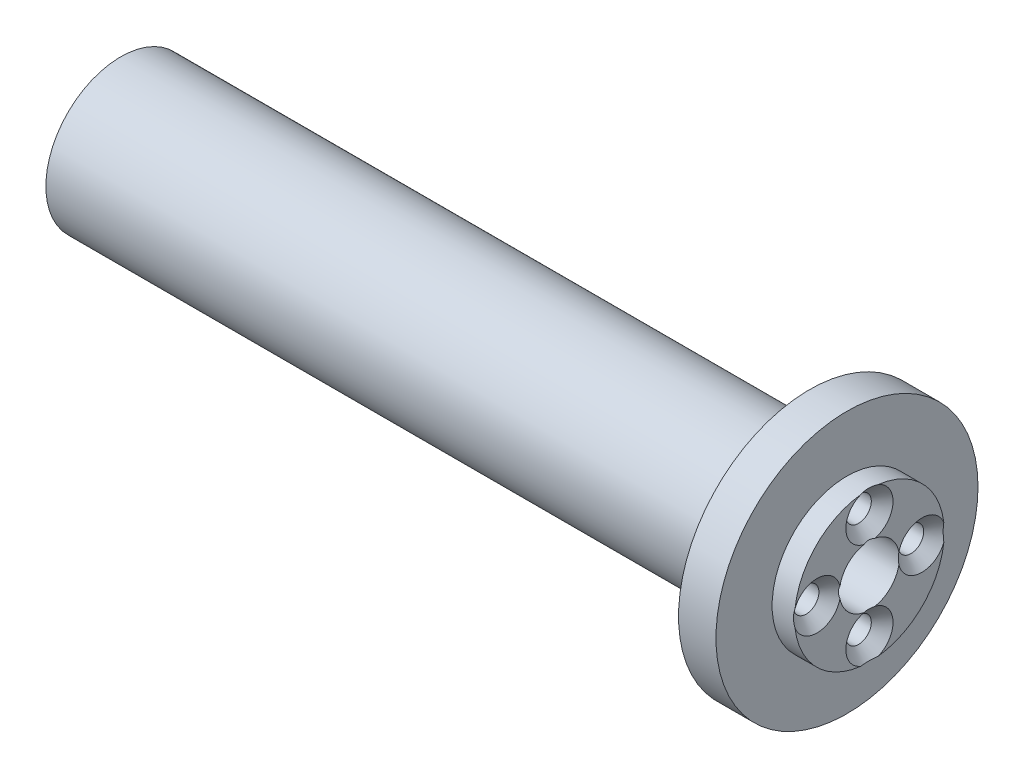
from build123d import *

# Parameters (mm, degrees)
CSK_FOR_M3_COUNTERSUNK_RAISED_HEAD_S_2_COUNT = 2
CSK_FOR_M3_COUNTERSUNK_RAISED_HEAD_S_2_PITCH = 9.899494937
CSK_FOR_M3_COUNTERSUNK_RAISED_HEAD_S_3_COUNT = 2
CSK_FOR_M3_COUNTERSUNK_RAISED_HEAD_S_3_PITCH = 14
CSK_FOR_M3_COUNTERSUNK_RAISED_HEAD_S_4_COUNT = 2
CSK_FOR_M3_COUNTERSUNK_RAISED_HEAD_S_4_PITCH = 9.899494937


with BuildPart() as part:
    # Sketch1 → Revolve2 (revolve)
    with BuildSketch(Plane(origin=(0, 0, 0), x_dir=(1, 0, 0), z_dir=(0, 1, 0))):
        Polygon((-3, 10), (-3, 17.5), (-8, 17.5), (-8, 10), (-100, 10), (-100, 0), (-19, 0), (-19, 4), (0, 4), (0, 10), align=None)
    revolve(axis=Axis((0, 0, 0), (-1, 0, 0)))


with BuildPart() as body_2:
    # Split1: the piece on the far side of the plane
    add(part.part)
    split(bisect_by=Plane(origin=(-8, 0, 0), x_dir=(0, 0, -1), z_dir=(-1, 0, 0)), keep=Keep.BOTTOM)


with BuildPart() as part_1:
    add(part.part)

    # Split1
    split(bisect_by=Plane(origin=(-8, 0, 0), x_dir=(0, 0, -1), z_dir=(-1, 0, 0)), keep=Keep.TOP)


with BuildPart() as csk_for_m3_countersunk_raised_head_screw_tool:
    # Sketch7 → CSK for M3 Countersunk Raised Head Screw2 (revolve)
    with BuildSketch(Plane(origin=(0, 0, 7), x_dir=(0, 0, -1), z_dir=(0, 1, 0))):
        Polygon((0, 0), (0, 11.021463052), (1.7, 10), (1.7, 1.45), (3.15, 0), align=None)
    csk_for_m3_countersunk_raised_head_screw = revolve(axis=Axis((6.35, 0, 7), (-1, 0, 0)))


with BuildPart() as part_2:
    add(part_1.part)

    # CSK for M3 Countersunk Raised Head Screw2: cut by csk_for_m3_countersunk_raised_head_screw_tool
    add(csk_for_m3_countersunk_raised_head_screw_tool.part, mode=Mode.SUBTRACT)


with BuildPart() as body_2_1:
    add(body_2.part)

    # CSK for M3 Countersunk Raised Head Screw2: cut by csk_for_m3_countersunk_raised_head_screw_tool
    add(csk_for_m3_countersunk_raised_head_screw_tool.part, mode=Mode.SUBTRACT)


with BuildPart() as csk_for_m3_countersunk_raised_head_s_2_tool:
    # CSK for M3 Countersunk Raised Head S 2: CSK for M3 Countersunk Raised Head Screw2 ×2
    with Locations(*[Vector(0, 0.7071067811865476, -0.7071067811865476) * (i * CSK_FOR_M3_COUNTERSUNK_RAISED_HEAD_S_2_PITCH) for i in range(1, CSK_FOR_M3_COUNTERSUNK_RAISED_HEAD_S_2_COUNT)]):
        add(csk_for_m3_countersunk_raised_head_screw)


with BuildPart() as part_3:
    add(part_2.part)

    # CSK for M3 Countersunk Raised Head S 2: cut by csk_for_m3_countersunk_raised_head_s_2_tool
    add(csk_for_m3_countersunk_raised_head_s_2_tool.part, mode=Mode.SUBTRACT)


with BuildPart() as body_2_2:
    add(body_2_1.part)

    # CSK for M3 Countersunk Raised Head S 2: cut by csk_for_m3_countersunk_raised_head_s_2_tool
    add(csk_for_m3_countersunk_raised_head_s_2_tool.part, mode=Mode.SUBTRACT)


with BuildPart() as csk_for_m3_countersunk_raised_head_s_3_tool:
    # CSK for M3 Countersunk Raised Head S 3: CSK for M3 Countersunk Raised Head Screw2 ×2
    with Locations(*[(0, 0, -i * CSK_FOR_M3_COUNTERSUNK_RAISED_HEAD_S_3_PITCH) for i in range(1, CSK_FOR_M3_COUNTERSUNK_RAISED_HEAD_S_3_COUNT)]):
        add(csk_for_m3_countersunk_raised_head_screw)


with BuildPart() as part_4:
    add(part_3.part)

    # CSK for M3 Countersunk Raised Head S 3: cut by csk_for_m3_countersunk_raised_head_s_3_tool
    add(csk_for_m3_countersunk_raised_head_s_3_tool.part, mode=Mode.SUBTRACT)


with BuildPart() as body_2_3:
    add(body_2_2.part)

    # CSK for M3 Countersunk Raised Head S 3: cut by csk_for_m3_countersunk_raised_head_s_3_tool
    add(csk_for_m3_countersunk_raised_head_s_3_tool.part, mode=Mode.SUBTRACT)


with BuildPart() as csk_for_m3_countersunk_raised_head_s_4_tool:
    # CSK for M3 Countersunk Raised Head S 4: CSK for M3 Countersunk Raised Head Screw2 ×2
    with Locations(*[Vector(0, -0.7071067811865476, -0.7071067811865476) * (i * CSK_FOR_M3_COUNTERSUNK_RAISED_HEAD_S_4_PITCH) for i in range(1, CSK_FOR_M3_COUNTERSUNK_RAISED_HEAD_S_4_COUNT)]):
        add(csk_for_m3_countersunk_raised_head_screw)


with BuildPart() as part_5:
    add(part_4.part)

    # CSK for M3 Countersunk Raised Head S 4: cut by csk_for_m3_countersunk_raised_head_s_4_tool
    add(csk_for_m3_countersunk_raised_head_s_4_tool.part, mode=Mode.SUBTRACT)


with BuildPart() as body_2_4:
    add(body_2_3.part)

    # CSK for M3 Countersunk Raised Head S 4: cut by csk_for_m3_countersunk_raised_head_s_4_tool
    add(csk_for_m3_countersunk_raised_head_s_4_tool.part, mode=Mode.SUBTRACT)


solid = Compound([part_5.part, body_2_4.part])
